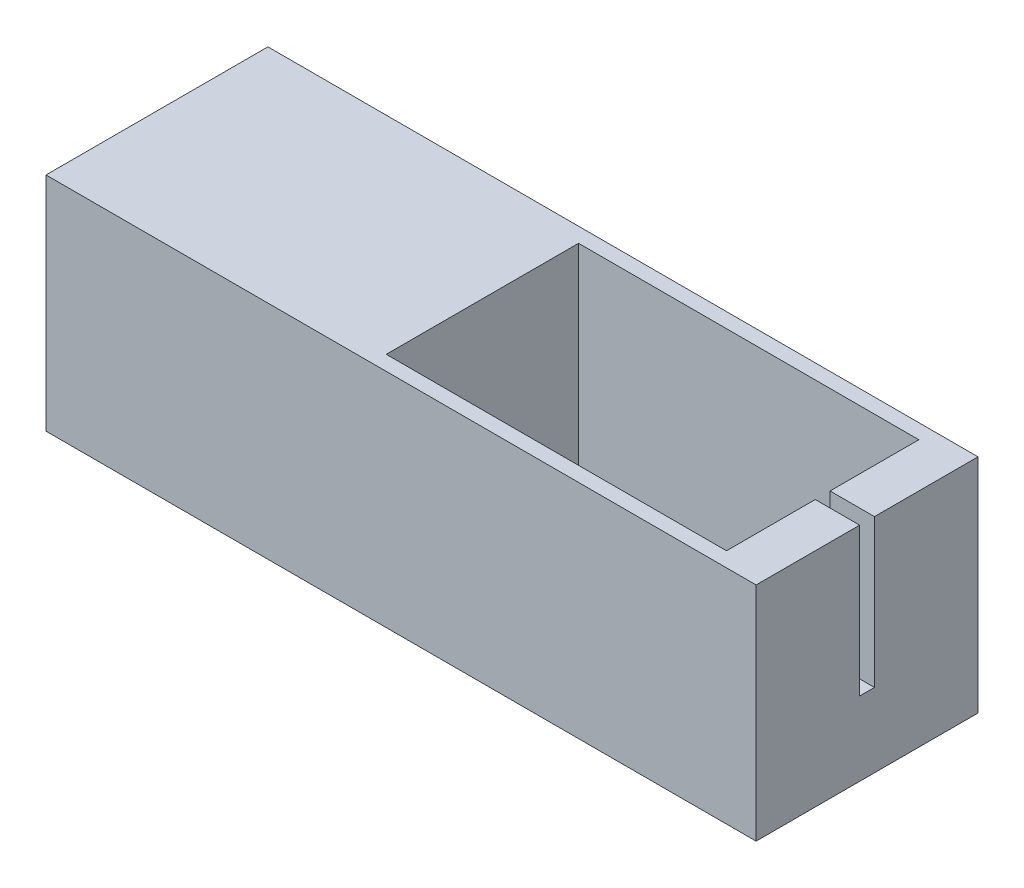
from build123d import *

# Parameters (mm, degrees)
SKETCH1_R               = 3.5
BOSS_EXTRUDE1_DEPTH     = 5
SKETCH2_R               = 2.5
CUT_EXTRUDE1_DEPTH      = 4.5
BOSS_EXTRUDE2_START     = -1
BOSS_EXTRUDE2_DEPTH     = 1
SKETCH4_W               = 22
SKETCH4_H               = 15
BOSS_EXTRUDE3_DEPTH     = 5
SKETCH5_W               = 22
SKETCH5_H               = 15
BOSS_EXTRUDE4_DEPTH     = 10
SKETCH7_W               = 15
SKETCH7_H               = 15
BOSS_EXTRUDE5_DEPTH     = 26
SKETCH8_W               = 23
SKETCH8_H               = 13
CUT_EXTRUDE2_DEPTH      = 24
SKETCH9_W               = 1
SKETCH9_H               = 10
CUT_EXTRUDE_THIN1_DEPTH = 3


with BuildPart() as part:
    # Sketch1 → Boss-Extrude1 (new body)
    with BuildSketch(Plane(origin=(0, 0, 0), x_dir=(1, 0, 0), z_dir=(0, 1, 0))):
        with Locations(Location((0, 0, 0), (0, 0, 270))):
            Circle(SKETCH1_R)
    extrude(amount=BOSS_EXTRUDE1_DEPTH)

    # Sketch2 → Cut-Extrude1 (cut)
    with BuildSketch(Plane.XZ):
        with Locations(Location((0, 0, 0), (0, 0, 270))):
            Circle(SKETCH2_R)
    extrude(amount=-CUT_EXTRUDE1_DEPTH, mode=Mode.SUBTRACT)

    # Sketch3 → Boss-Extrude2 (add)
    with BuildSketch(Plane(origin=(0, 5, 0), x_dir=(1, 0, 0), z_dir=(0, 1, 0)).offset(BOSS_EXTRUDE2_START)):
        with BuildLine():
            Line((0.374137931, -3.479945518), (14.708448276, -1.938826789))
            ThreePointArc((14.708448276, -1.938826789), (16.45, 0), (14.708448276, 1.938826789))
            Line((14.708448276, 1.938826789), (0.374137931, 3.479945518))
            ThreePointArc((0.374137931, 3.479945518), (3.5, 0), (0.374137931, -3.479945518))
        make_face()
    extrude(amount=BOSS_EXTRUDE2_DEPTH)


with BuildPart() as body_2:
    # Sketch4 → Boss-Extrude3 (new body)
    with BuildSketch(Plane(origin=(0, 5, 0), x_dir=(1, 0, 0), z_dir=(0, 1, 0))):
        with Locations((6.5, 0)):
            Rectangle(SKETCH4_W, SKETCH4_H)
        with BuildLine():
            Line((0.374137931, -3.479945518), (14.708448276, -1.938826789))
            ThreePointArc((14.708448276, -1.938826789), (16.45, 0), (14.708448276, 1.938826789))
            Line((14.708448276, 1.938826789), (0.374137931, 3.479945518))
            ThreePointArc((0.374137931, 3.479945518), (-3.5, 0), (0.374137931, -3.479945518))
        make_face(mode=Mode.SUBTRACT)
    extrude(amount=-BOSS_EXTRUDE3_DEPTH)

    # Sketch5 → Boss-Extrude4 (add)
    with BuildSketch(Plane(origin=(0, 5, 0), x_dir=(1, 0, 0), z_dir=(0, 1, 0))):
        with Locations((6.5, 0)):
            Rectangle(SKETCH5_W, SKETCH5_H)
    extrude(amount=BOSS_EXTRUDE4_DEPTH)

    # Sketch7 → Boss-Extrude5 (add)
    with BuildSketch(Plane(origin=(17.5, 0, 0), x_dir=(0, 0, -1), z_dir=(1, 0, 0))):
        with Locations((0, 7.5)):
            Rectangle(SKETCH7_W, SKETCH7_H)
    extrude(amount=BOSS_EXTRUDE5_DEPTH)

    # Sketch8 → Cut-Extrude2 (cut)
    with BuildSketch(Plane.XZ):
        with Locations((29, 0)):
            Rectangle(SKETCH8_W, SKETCH8_H)
    extrude(amount=-CUT_EXTRUDE2_DEPTH, mode=Mode.SUBTRACT)

    # Sketch9 → Cut-Extrude-Thin1 (cut)
    with BuildSketch(Plane(origin=(43.5, 0, 0), x_dir=(0, 0, -1), z_dir=(1, 0, 0))):
        with Locations((0, 10)):
            Rectangle(SKETCH9_W, SKETCH9_H)
    extrude(amount=-CUT_EXTRUDE_THIN1_DEPTH, mode=Mode.SUBTRACT)


solid = Compound([part.part, body_2.part])
